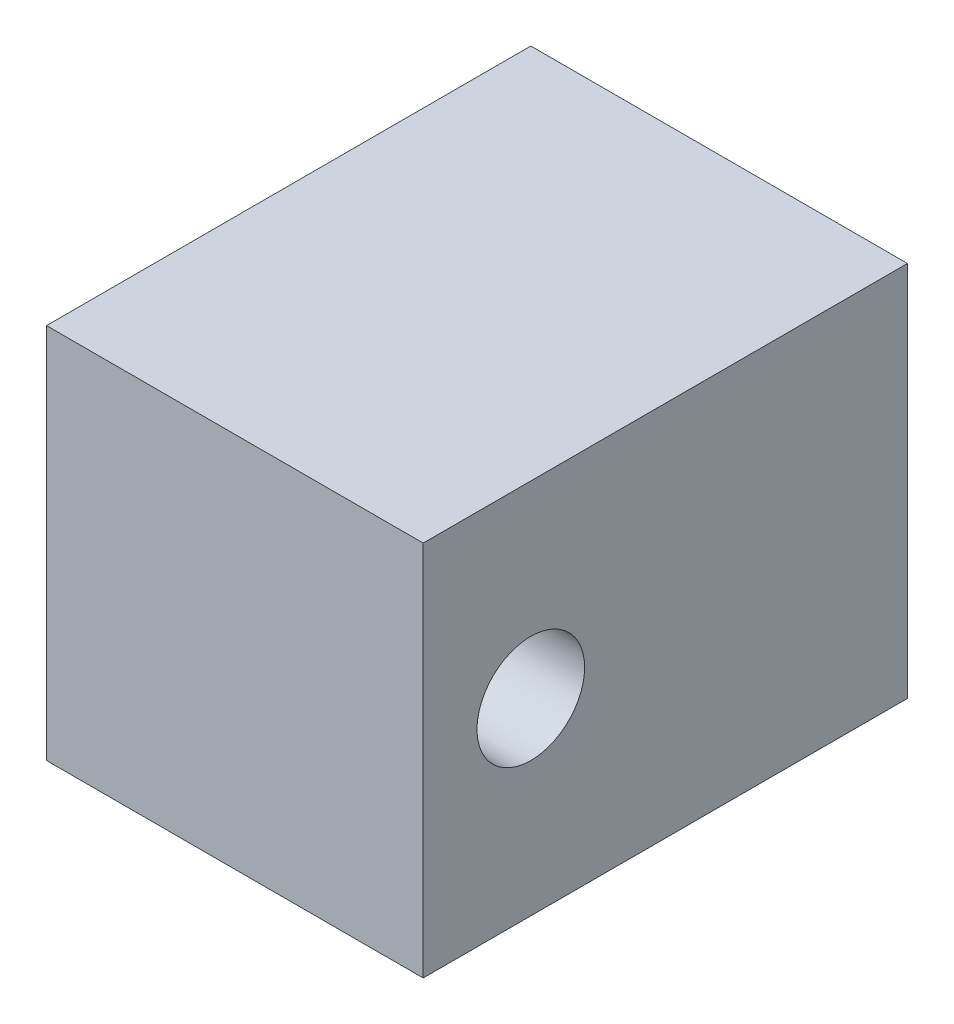
from build123d import *

# Parameters (mm, degrees)
SKETCH_1_W          = 14
SKETCH_1_H          = 14
SKETCH_1_W_2        = 12
SKETCH_1_H_2        = 12
EXTRUDE_1_DEPTH     = 10
SKETCH_2_W          = 14
SKETCH_2_H          = 14
EXTRUDE_2_DEPTH     = 8
SKETCH_3_R          = 2
CUT_EXTRUDE_1_DEPTH = 14


with BuildPart() as part:
    # 草图1 → 凸台-拉伸1 (new body)
    with BuildSketch(Plane.XY):
        with Locations((7, 7)):
            Rectangle(SKETCH_1_W, SKETCH_1_H)
        with Locations((7, 7)):
            Rectangle(SKETCH_1_W_2, SKETCH_1_H_2, mode=Mode.SUBTRACT)
    extrude(amount=EXTRUDE_1_DEPTH)

    # 草图2 → 凸台-拉伸2 (add)
    with BuildSketch(Plane.XY.offset(10)):
        with Locations((7, 7)):
            Rectangle(SKETCH_2_W, SKETCH_2_H)
    extrude(amount=EXTRUDE_2_DEPTH)

    # 草图3 → 切除-拉伸1 (cut)
    with BuildSketch(Plane(origin=(14, 0, 0), x_dir=(0, 0, -1), z_dir=(1, 0, 0))):
        with Locations((-14, 7)):
            Circle(SKETCH_3_R)
    extrude(amount=-CUT_EXTRUDE_1_DEPTH, mode=Mode.SUBTRACT)


solid = part.part
